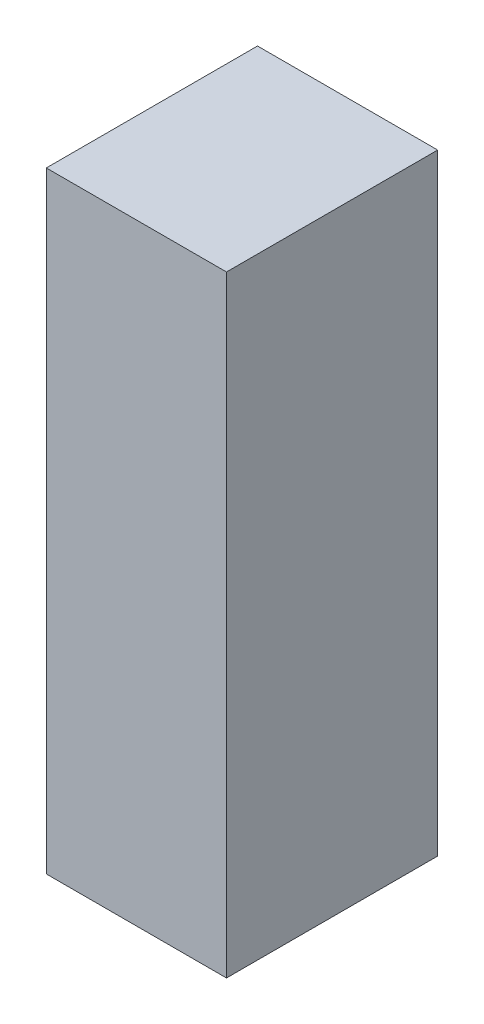
from build123d import *

# Parameters (mm, degrees)
SKETCH1_W           = 309.88
SKETCH1_H           = 363.22
BOSS_EXTRUDE1_DEPTH = 1051.56


with BuildPart() as part:
    # Sketch1 → Boss-Extrude1 (new body)
    with BuildSketch(Plane(origin=(0, 0, 0), x_dir=(1, 0, 0), z_dir=(0, 1, 0))):
        with Locations((154.94, 181.61)):
            Rectangle(SKETCH1_W, SKETCH1_H)
    extrude(amount=BOSS_EXTRUDE1_DEPTH)


solid = part.part
